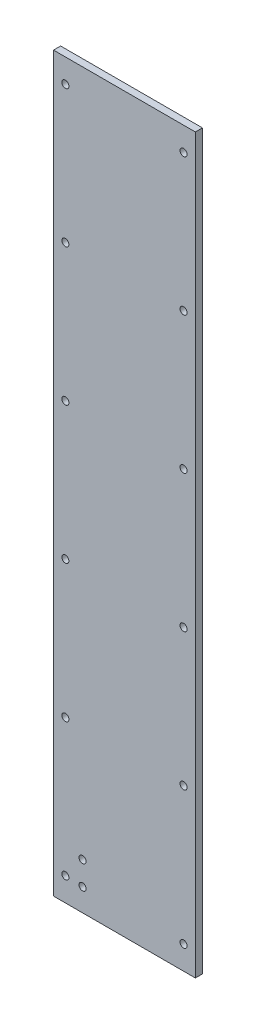
from build123d import *

# Parameters (mm, degrees)
ESQUISSE1_R        = 1.5
BOSS_EXTRU_1_DEPTH = 3


with BuildPart() as part:
    # Esquisse1 → Boss.-Extru.1 (new body)
    with BuildSketch(Plane.XY):
        Polygon((-20, -155), (30, -155), (30, 155), (-20, 155), (-30, 155), (-30, 150), (-30, -150), (-30, -155), align=None)
        with Locations((-25, -145)):
            Circle(ESQUISSE1_R, mode=Mode.SUBTRACT)
        with Locations((-17.728308863, -145.455320997)):
            Circle(ESQUISSE1_R, mode=Mode.SUBTRACT)
        with Locations((-17.728308863, -135.455320997)):
            Circle(ESQUISSE1_R, mode=Mode.SUBTRACT)
        with Locations((-25, -87)):
            Circle(ESQUISSE1_R, mode=Mode.SUBTRACT)
        with Locations((-25, -29)):
            Circle(ESQUISSE1_R, mode=Mode.SUBTRACT)
        with Locations((25, -145)):
            Circle(ESQUISSE1_R, mode=Mode.SUBTRACT)
        with Locations((25, -87)):
            Circle(ESQUISSE1_R, mode=Mode.SUBTRACT)
        with Locations((25, -29)):
            Circle(ESQUISSE1_R, mode=Mode.SUBTRACT)
        with Locations((-25, 29)):
            Circle(ESQUISSE1_R, mode=Mode.SUBTRACT)
        with Locations((-25, 87)):
            Circle(ESQUISSE1_R, mode=Mode.SUBTRACT)
        with Locations((-25, 145)):
            Circle(ESQUISSE1_R, mode=Mode.SUBTRACT)
        with Locations((25, 29)):
            Circle(ESQUISSE1_R, mode=Mode.SUBTRACT)
        with Locations((25, 87)):
            Circle(ESQUISSE1_R, mode=Mode.SUBTRACT)
        with Locations((25, 145)):
            Circle(ESQUISSE1_R, mode=Mode.SUBTRACT)
    extrude(amount=BOSS_EXTRU_1_DEPTH)


solid = part.part
